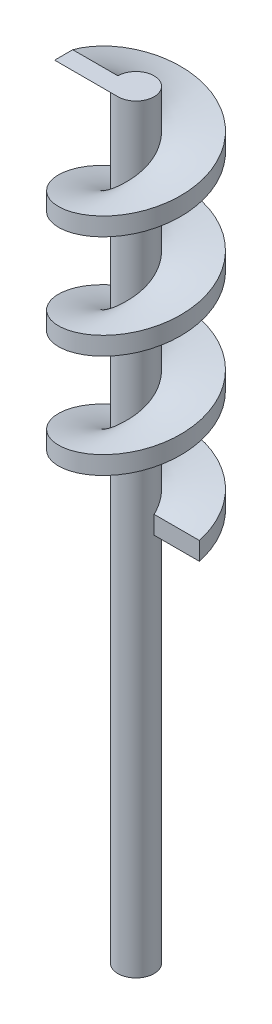
from build123d import *

# Parameters (mm, degrees)
SKETCH2_R                = 1
BOSS_EXTRUDE1_DEPTH      = 44
SWEEP1_PITCH             = 5.714285714
SWEEP1_HEIGHT            = 20
SWEEP1_RADIUS            = 3.5
SWEEP1_START_ANGLE       = -90
SKETCH5_W                = 2.499443459
SKETCH5_H                = 1
BOSS_EXTRUDE2_REACH      = 46.69
BOSS_EXTRUDE2_END_RADIUS = 1
SKETCH8_R                = 1
CUT_EXTRUDE1_DEPTH       = 2


with BuildPart() as part:
    # Sketch2 → Boss-Extrude1 (new body)
    with BuildSketch(Plane(origin=(0, 0, 0), x_dir=(1, 0, 0), z_dir=(0, 1, 0))):
        with Locations(Location((0, 0, 0), (0, 0, 270))):
            Circle(SKETCH2_R)
    extrude(amount=BOSS_EXTRUDE1_DEPTH)

    # Sweep1: sweep along a helix
    with BuildLine() as sweep1_path:
        add(Helix(SWEEP1_PITCH, SWEEP1_HEIGHT, SWEEP1_RADIUS, center=(0, 44, 0), direction=(0, -1, 0), mode=Mode.PRIVATE).rotate(Axis((0, 44, 0), (0, -1, 0)), SWEEP1_START_ANGLE))
    # Sketch5 → Sweep1 (sweep)
    with BuildSketch(Plane.XY):
        with Locations((-2.24972173, 43.5)):
            Rectangle(SKETCH5_W, SKETCH5_H)
    sweep(path=sweep1_path.line, is_frenet=True)

    # Boss-Extrude2: up to this cylinder (the profile starts outside it)
    boss_extrude2_end = Plane(origin=(0, 43.666667, 0), z_dir=(0, -1, 0)) * Cylinder(BOSS_EXTRUDE2_END_RADIUS, 96.38, mode=Mode.PRIVATE)
    # Sketch6 → Boss-Extrude2 (add, up to the surface)
    with BuildSketch(Plane(origin=(-3.499443459, 0, 0), x_dir=(0, -1, 0), z_dir=(-1, 0, 0)), mode=Mode.PRIVATE) as boss_extrude2_sk1:
        Polygon((-43, 0), (-44, 0), (-44, 1), align=None)
    boss_extrude2_tool1 = extrude(boss_extrude2_sk1.sketch, amount=-BOSS_EXTRUDE2_REACH, mode=Mode.PRIVATE) - boss_extrude2_end
    add(boss_extrude2_tool1.solids().sort_by_distance((-3.499443, 43.666667, 0.333333))[0])

    # Sketch8 → Cut-Extrude1 (cut)
    with BuildSketch(Plane.XZ):
        with Locations(Location((0, 0, 0), (0, 0, 270))):
            Circle(SKETCH8_R)
    extrude(amount=-CUT_EXTRUDE1_DEPTH, mode=Mode.SUBTRACT)


solid = part.part
